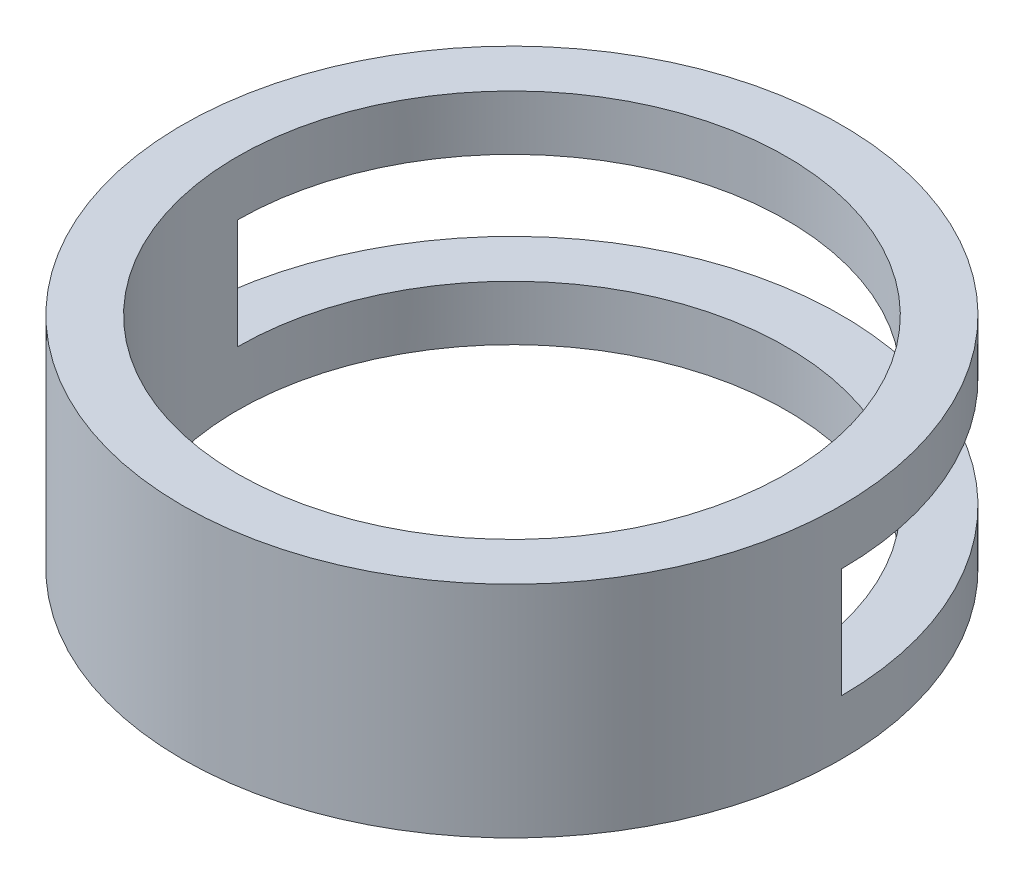
from build123d import *

# Parameters (mm, degrees)
SKETCH1_R           = 30
SKETCH1_R_2         = 25
BOSS_EXTRUDE1_DEPTH = 10
CUT_EXTRUDE1_DEPTH  = 5


with BuildPart() as part:
    # Sketch1 → Boss-Extrude1 (new, symmetric)
    with BuildSketch(Plane(origin=(0, 0, 0), x_dir=(1, 0, 0), z_dir=(0, 1, 0))):
        with Locations(Location((0, 0, 0), (0, 0, 270))):
            Circle(SKETCH1_R)
        with Locations(Location((0, 0, 0), (0, 0, 270))):
            Circle(SKETCH1_R_2, mode=Mode.SUBTRACT)
    extrude(amount=BOSS_EXTRUDE1_DEPTH, both=True)

    # Sketch3 → Cut-Extrude1 (cut, symmetric)
    with BuildSketch(Plane(origin=(0, 0, 0), x_dir=(1, 0, 0), z_dir=(0, 1, 0))):
        with BuildLine():
            ThreePointArc((-25, 0), (0, 25), (25, 0))
            Line((25, 0), (30, 0))
            ThreePointArc((30, 0), (0, 30), (-30, 0))
            Line((-30, 0), (-25, 0))
        make_face()
    extrude(amount=CUT_EXTRUDE1_DEPTH, both=True, mode=Mode.SUBTRACT)


solid = part.part
